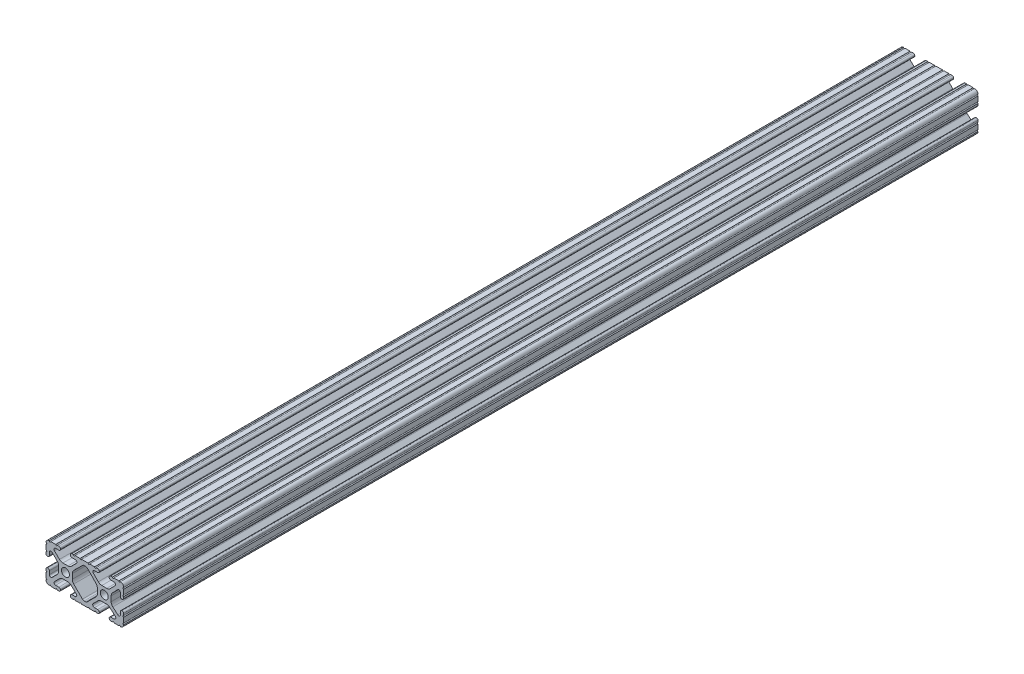
from build123d import *

# Parameters (mm, degrees)
SKETCH1_R           = 2.6035
BOSS_EXTRUDE1_DEPTH = 279.4


with BuildPart() as part:
    # Sketch1 → Boss-Extrude1 (new, symmetric)
    with BuildSketch(Plane.XY):
        with BuildLine():
            Line((18.01710265, 12.7), (16.98745015, 12.7))
            ThreePointArc((16.98745015, 12.7), (16.245730386, 12.392769614), (15.9385, 11.65104985))
            Line((15.9385, 11.65104985), (15.9385, 11.53922))
            ThreePointArc((15.9385, 11.53922), (16.245750844, 10.797450844), (16.98752, 10.4902))
            Line((16.98752, 10.4902), (19.116384363, 10.4902))
            ThreePointArc((19.116384363, 10.4902), (20.052502933, 9.869096983), (19.844087081, 8.765172272))
            Line((19.844087081, 8.765172272), (16.618993479, 5.455112286))
            ThreePointArc((16.618993479, 5.455112286), (15.578994274, 4.745442459), (14.344932584, 4.4958))
            Line((14.344932584, 4.4958), (11.083317835, 4.4958))
            ThreePointArc((11.083317835, 4.4958), (9.854330953, 4.743306833), (8.816955189, 5.447238587))
            Line((8.816955189, 5.447238587), (5.564154119, 8.762652677))
            ThreePointArc((5.564154119, 8.762652677), (5.352591412, 9.867473037), (6.289393385, 10.4902))
            Line((6.289393385, 10.4902), (8.41248, 10.4902))
            ThreePointArc((8.41248, 10.4902), (9.154249156, 10.797450844), (9.4615, 11.53922))
            Line((9.4615, 11.53922), (9.4615, 11.65104985))
            ThreePointArc((9.4615, 11.65104985), (9.154269614, 12.392769614), (8.41254985, 12.7))
            Line((8.41254985, 12.7), (7.38288465, 12.7))
            ThreePointArc((7.38288465, 12.7), (6.87488465, 12.192), (6.36688465, 12.7))
            Line((6.36688465, 12.7), (3.14958095, 12.7))
            ThreePointArc((3.14958095, 12.7), (2.64158095, 12.192), (2.13358095, 12.7))
            Line((2.13358095, 12.7), (-2.13358095, 12.7))
            ThreePointArc((-2.13358095, 12.7), (-2.64158095, 12.192), (-3.14958095, 12.7))
            Line((-3.14958095, 12.7), (-6.36689735, 12.7))
            ThreePointArc((-6.36689735, 12.7), (-6.87489735, 12.192), (-7.38289735, 12.7))
            Line((-7.38289735, 12.7), (-8.41254985, 12.7))
            ThreePointArc((-8.41254985, 12.7), (-9.154269614, 12.392769614), (-9.4615, 11.65104985))
            Line((-9.4615, 11.65104985), (-9.4615, 11.53922))
            ThreePointArc((-9.4615, 11.53922), (-9.154249156, 10.797450844), (-8.41248, 10.4902))
            Line((-8.41248, 10.4902), (-6.283641037, 10.4902))
            ThreePointArc((-6.283641037, 10.4902), (-5.297291557, 9.829633109), (-5.532576693, 8.666071843))
            Line((-5.532576693, 8.666071843), (-8.809985098, 5.416263103))
            ThreePointArc((-8.809985098, 5.416263103), (-9.836720513, 4.734920264), (-11.045536121, 4.4958))
            Line((-11.045536121, 4.4958), (-14.354463879, 4.4958))
            ThreePointArc((-14.354463879, 4.4958), (-15.563279487, 4.734920264), (-16.590014902, 5.416263103))
            Line((-16.590014902, 5.416263103), (-19.867423307, 8.666071843))
            ThreePointArc((-19.867423307, 8.666071843), (-20.102708443, 9.829633109), (-19.116358963, 10.4902))
            Line((-19.116358963, 10.4902), (-16.98752, 10.4902))
            ThreePointArc((-16.98752, 10.4902), (-16.245750844, 10.797450844), (-15.9385, 11.53922))
            Line((-15.9385, 11.53922), (-15.9385, 11.65104985))
            ThreePointArc((-15.9385, 11.65104985), (-16.245730386, 12.392769614), (-16.98745015, 12.7))
            Line((-16.98745015, 12.7), (-18.01711535, 12.7))
            ThreePointArc((-18.01711535, 12.7), (-18.52511535, 12.192), (-19.03311535, 12.7))
            Line((-19.03311535, 12.7), (-22.2504, 12.7))
            ThreePointArc((-22.2504, 12.7), (-22.758323491, 12.192000006), (-23.266399977, 12.699846982))
            ThreePointArc((-23.266399977, 12.699846982), (-24.782522516, 12.082522516), (-25.399846982, 10.566399977))
            ThreePointArc((-25.399846982, 10.566399977), (-24.892000006, 10.058323491), (-25.4, 9.5504))
            Line((-25.4, 9.5504), (-25.4, 6.3330836))
            ThreePointArc((-25.4, 6.3330836), (-24.892, 5.8250836), (-25.4, 5.3170836))
            Line((-25.4, 5.3170836), (-25.4, 4.237520184))
            ThreePointArc((-25.4, 4.237520184), (-25.107393763, 3.531106237), (-24.400979816, 3.2385))
            Line((-24.400979816, 3.2385), (-24.23922, 3.2385))
            ThreePointArc((-24.23922, 3.2385), (-23.497450844, 3.545750844), (-23.1902, 4.28752))
            Line((-23.1902, 4.28752), (-23.1902, 6.334741132))
            ThreePointArc((-23.1902, 6.334741132), (-22.556026952, 7.286023527), (-21.434002553, 7.066535717))
            Line((-21.434002553, 7.066535717), (-18.147950853, 3.808156468))
            ThreePointArc((-18.147950853, 3.808156468), (-17.452759693, 2.774838327), (-17.208501877, 1.553619571))
            Line((-17.208501877, 1.553619571), (-17.208501877, -1.695179196))
            ThreePointArc((-17.208501877, -1.695179196), (-17.450738657, -2.911536421), (-18.140486065, -3.942289578))
            Line((-18.140486065, -3.942289578), (-21.431579576, -7.227386226))
            ThreePointArc((-21.431579576, -7.227386226), (-22.55444896, -7.449940594), (-23.1902, -6.498002195))
            Line((-23.1902, -6.498002195), (-23.1902, -4.28752))
            ThreePointArc((-23.1902, -4.28752), (-23.497450844, -3.545750844), (-24.23922, -3.2385))
            Line((-24.23922, -3.2385), (-24.35098, -3.2385))
            ThreePointArc((-24.35098, -3.2385), (-25.092749156, -3.545750844), (-25.4, -4.28752))
            Line((-25.4, -4.28752), (-25.4, -5.3171344))
            ThreePointArc((-25.4, -5.3171344), (-24.892, -5.8251344), (-25.4, -6.3331344))
            Line((-25.4, -6.3331344), (-25.4, -9.5504))
            ThreePointArc((-25.4, -9.5504), (-24.892000006, -10.058323491), (-25.399846982, -10.566399977))
            ThreePointArc((-25.399846982, -10.566399977), (-24.782522516, -12.082522516), (-23.266399977, -12.699846982))
            ThreePointArc((-23.266399977, -12.699846982), (-22.758323491, -12.192000006), (-22.2504, -12.7))
            Line((-22.2504, -12.7), (-19.03308995, -12.7))
            ThreePointArc((-19.03308995, -12.7), (-18.52508995, -12.192), (-18.01708995, -12.7))
            Line((-18.01708995, -12.7), (-16.9874692, -12.7))
            ThreePointArc((-16.9874692, -12.7), (-16.245700044, -12.392749156), (-15.9384492, -11.65098))
            Line((-15.9384492, -11.65098), (-15.9384492, -11.53922))
            ThreePointArc((-15.9384492, -11.53922), (-16.245700044, -10.797450844), (-16.9874692, -10.4902))
            Line((-16.9874692, -10.4902), (-19.116358963, -10.4902))
            ThreePointArc((-19.116358963, -10.4902), (-20.055197748, -9.862578342), (-19.834124023, -8.755124678))
            Line((-19.834124023, -8.755124678), (-16.49660751, -5.423689618))
            ThreePointArc((-16.49660751, -5.423689618), (-15.467274017, -4.736928798), (-14.253591699, -4.4958))
            Line((-14.253591699, -4.4958), (-11.146408301, -4.4958))
            ThreePointArc((-11.146408301, -4.4958), (-9.932725983, -4.736928798), (-8.90339249, -5.423689618))
            Line((-8.90339249, -5.423689618), (-5.565875977, -8.755124678))
            ThreePointArc((-5.565875977, -8.755124678), (-5.344802252, -9.862578342), (-6.283641037, -10.4902))
            Line((-6.283641037, -10.4902), (-8.4125308, -10.4902))
            ThreePointArc((-8.4125308, -10.4902), (-9.154299956, -10.797450844), (-9.4615508, -11.53922))
            Line((-9.4615508, -11.53922), (-9.4615508, -11.65098))
            ThreePointArc((-9.4615508, -11.65098), (-9.154299956, -12.392749156), (-8.4125308, -12.7))
            Line((-8.4125308, -12.7), (-7.38287195, -12.7))
            ThreePointArc((-7.38287195, -12.7), (-6.87487195, -12.192), (-6.36687195, -12.7))
            Line((-6.36687195, -12.7), (-3.14960635, -12.7))
            ThreePointArc((-3.14960635, -12.7), (-2.64160635, -12.192), (-2.13360635, -12.7))
            Line((-2.13360635, -12.7), (2.13360635, -12.7))
            ThreePointArc((2.13360635, -12.7), (2.64159365, -12.1920127), (3.14958095, -12.7))
            Line((3.14958095, -12.7), (6.36691005, -12.7))
            ThreePointArc((6.36691005, -12.7), (6.87491005, -12.192), (7.38291005, -12.7))
            Line((7.38291005, -12.7), (8.4125308, -12.7))
            ThreePointArc((8.4125308, -12.7), (9.154299956, -12.392749156), (9.4615508, -11.65098))
            Line((9.4615508, -11.65098), (9.4615508, -11.53922))
            ThreePointArc((9.4615508, -11.53922), (9.154299956, -10.797450844), (8.4125308, -10.4902))
            Line((8.4125308, -10.4902), (6.289393385, -10.4902))
            ThreePointArc((6.289393385, -10.4902), (5.231590322, -9.783049717), (5.480677245, -8.535265862))
            Line((5.480677245, -8.535265862), (8.597933595, -5.423689618))
            ThreePointArc((8.597933595, -5.423689618), (9.627267088, -4.736928798), (10.840949406, -4.4958))
            Line((10.840949406, -4.4958), (14.102564155, -4.4958))
            ThreePointArc((14.102564155, -4.4958), (15.215927525, -4.697410182), (16.187895372, -5.276636531))
            Line((16.187895372, -5.276636531), (19.868247549, -8.482246082))
            ThreePointArc((19.868247549, -8.482246082), (20.188435806, -9.746879864), (19.116384363, -10.4902))
            Line((19.116384363, -10.4902), (16.9874692, -10.4902))
            ThreePointArc((16.9874692, -10.4902), (16.245700044, -10.797450844), (15.9384492, -11.53922))
            Line((15.9384492, -11.53922), (15.9384492, -11.65098))
            ThreePointArc((15.9384492, -11.65098), (16.245700044, -12.392749156), (16.9874692, -12.7))
            Line((16.9874692, -12.7), (18.01710265, -12.7))
            ThreePointArc((18.01710265, -12.7), (18.52510265, -12.192), (19.03310265, -12.7))
            Line((19.03310265, -12.7), (22.2504, -12.7))
            ThreePointArc((22.2504, -12.7), (22.758323491, -12.192000006), (23.266399977, -12.699846982))
            ThreePointArc((23.266399977, -12.699846982), (24.782522516, -12.082522516), (25.399846982, -10.566399977))
            ThreePointArc((25.399846982, -10.566399977), (24.892000006, -10.058323492), (25.4, -9.550400001))
            Line((25.4, -9.550400001), (25.4, -6.333083592))
            ThreePointArc((25.4, -6.333083592), (24.892000001, -5.825083593), (25.4, -5.317083593))
            Line((25.4, -5.317083593), (25.4, -4.237520184))
            ThreePointArc((25.4, -4.237520184), (25.107393763, -3.531106237), (24.400979816, -3.2385))
            Line((24.400979816, -3.2385), (24.189220184, -3.2385))
            ThreePointArc((24.189220184, -3.2385), (23.482806237, -3.531106237), (23.1902, -4.237520184))
            Line((23.1902, -4.237520184), (23.1902, -6.155876159))
            ThreePointArc((23.1902, -6.155876159), (22.62232736, -7.038258539), (21.583974541, -6.886926384))
            Line((21.583974541, -6.886926384), (18.29817066, -4.024970844))
            ThreePointArc((18.29817066, -4.024970844), (17.493730985, -2.946044689), (17.208501877, -1.630807374))
            Line((17.208501877, -1.630807374), (17.208501877, 1.630807374))
            ThreePointArc((17.208501877, 1.630807374), (17.442348332, 2.82673414), (18.109440981, 3.846495088))
            Line((18.109440981, 3.846495088), (21.526346532, 7.353420386))
            ThreePointArc((21.526346532, 7.353420386), (22.585896263, 7.574939077), (23.1902, 6.676867167))
            Line((23.1902, 6.676867167), (23.1902, 4.237520184))
            ThreePointArc((23.1902, 4.237520184), (23.482806237, 3.531106237), (24.189220184, 3.2385))
            Line((24.189220184, 3.2385), (24.400979816, 3.2385))
            ThreePointArc((24.400979816, 3.2385), (25.107393763, 3.531106237), (25.4, 4.237520184))
            Line((25.4, 4.237520184), (25.4, 5.3170836))
            ThreePointArc((25.4, 5.3170836), (24.891949193, 5.825134407), (25.4, 6.333185215))
            Line((25.4, 6.333185215), (25.4, 9.550400015))
            ThreePointArc((25.4, 9.550400015), (24.892000013, 10.058323498), (25.399846982, 10.566399977))
            ThreePointArc((25.399846982, 10.566399977), (24.782522516, 12.082522516), (23.266399977, 12.699846982))
            ThreePointArc((23.266399977, 12.699846982), (22.758323491, 12.192000006), (22.2504, 12.7))
            Line((22.2504, 12.7), (19.03310265, 12.7))
            ThreePointArc((19.03310265, 12.7), (18.52510265, 12.192), (18.01710265, 12.7))
        make_face()
        with Locations((-12.7, 0)):
            Circle(SKETCH1_R, mode=Mode.SUBTRACT)
        with Locations((12.7, 0)):
            Circle(SKETCH1_R, mode=Mode.SUBTRACT)
        with BuildLine():
            Line((-7.259513935, -3.869413038), (-1.545748891, -9.572766749))
            ThreePointArc((-1.545748891, -9.572766749), (-1.035199478, -9.913400116), (-0.433213048, -10.033))
            Line((-0.433213048, -10.033), (0.433213048, -10.033))
            ThreePointArc((0.433213048, -10.033), (1.035199478, -9.913400116), (1.545748891, -9.572766749))
            Line((1.545748891, -9.572766749), (7.259513935, -3.869413038))
            ThreePointArc((7.259513935, -3.869413038), (7.949261343, -2.838659881), (8.191498123, -1.622302656))
            Line((8.191498123, -1.622302656), (8.191498123, 1.622302656))
            ThreePointArc((8.191498123, 1.622302656), (7.955573352, 2.823327967), (7.282860769, 3.845864069))
            Line((7.282860769, 3.845864069), (1.675572808, 9.561086461))
            ThreePointArc((1.675572808, 9.561086461), (1.161034429, 9.910236611), (0.551456936, 10.033))
            Line((0.551456936, 10.033), (-0.395199982, 10.033))
            ThreePointArc((-0.395199982, 10.033), (-0.994772524, 9.914396349), (-1.50403329, 9.576450301))
            Line((-1.50403329, 9.576450301), (-7.252049147, 3.876839553))
            ThreePointArc((-7.252049147, 3.876839553), (-7.947240307, 2.843521412), (-8.191498123, 1.622302656))
            Line((-8.191498123, 1.622302656), (-8.191498123, -1.622302656))
            ThreePointArc((-8.191498123, -1.622302656), (-7.949261343, -2.838659881), (-7.259513935, -3.869413038))
        make_face(mode=Mode.SUBTRACT)
    extrude(amount=BOSS_EXTRUDE1_DEPTH, both=True)


solid = part.part
